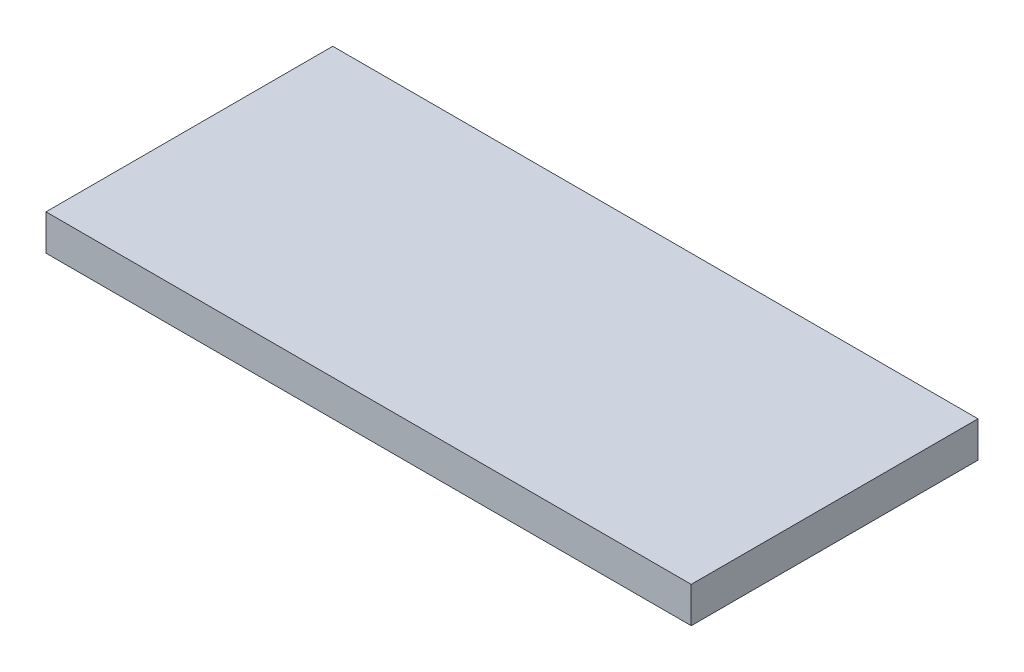
from build123d import *

# Parameters (mm, degrees)
SKETCH1_W           = 45.72
SKETCH1_H           = 20.32
BOSS_EXTRUDE1_DEPTH = 2.54


with BuildPart() as part:
    # Sketch1 → Boss-Extrude1 (new body)
    with BuildSketch(Plane(origin=(0, 0, 0), x_dir=(1, 0, 0), z_dir=(0, 1, 0))):
        with Locations((22.86, -10.16)):
            Rectangle(SKETCH1_W, SKETCH1_H)
    extrude(amount=BOSS_EXTRUDE1_DEPTH)


solid = part.part
